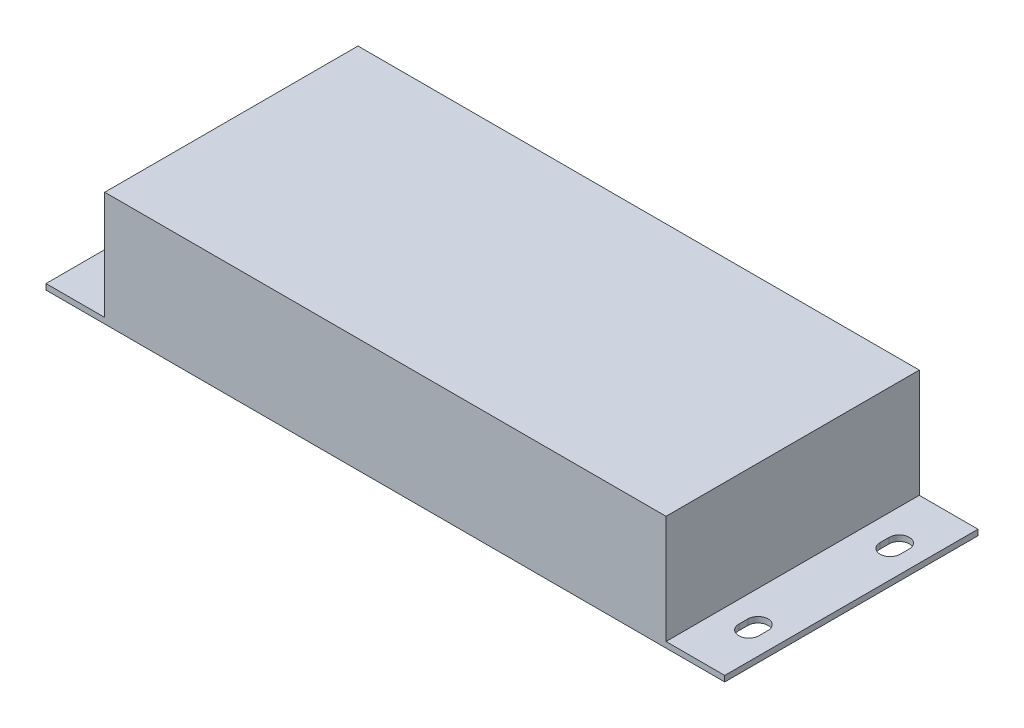
from build123d import *

# Parameters (mm, degrees)
SKETCH1_W           = 99.9236
SKETCH1_H           = 45.085
BOSS_EXTRUDE1_DEPTH = 19.304
SKETCH2_W           = 120.8278
SKETCH2_H           = 45.085
BOSS_EXTRUDE2_DEPTH = 1.016
SKETCH3_W           = 86.580193544
SKETCH3_H           = 5.780372674
CUT_EXTRUDE1_DEPTH  = 5


with BuildPart() as part:
    # Sketch1 → Boss-Extrude1 (new body)
    with BuildSketch(Plane(origin=(0, 0, 0), x_dir=(1, 0, 0), z_dir=(0, 1, 0))):
        with Locations((49.9618, 22.5425)):
            Rectangle(SKETCH1_W, SKETCH1_H)
    extrude(amount=BOSS_EXTRUDE1_DEPTH)

    # Sketch2 → Boss-Extrude2 (add)
    with BuildSketch(Plane.XZ):
        with Locations((49.9618, -22.5425)):
            Rectangle(SKETCH2_W, SKETCH2_H)
        with BuildLine():
            Line((-3.7973, -9.1567), (-3.7973, -10.7823))
            ThreePointArc((-3.7973, -10.7823), (-5.588, -12.573), (-7.3787, -10.7823))
            Line((-7.3787, -10.7823), (-7.3787, -9.1567))
            ThreePointArc((-7.3787, -9.1567), (-5.588, -7.366), (-3.7973, -9.1567))
        make_face(mode=Mode.SUBTRACT)
        with BuildLine():
            Line((-3.7973, -35.9283), (-3.7973, -34.3027))
            ThreePointArc((-3.7973, -34.3027), (-5.588, -32.512), (-7.3787, -34.3027))
            Line((-7.3787, -34.3027), (-7.3787, -35.9283))
            ThreePointArc((-7.3787, -35.9283), (-5.588, -37.719), (-3.7973, -35.9283))
        make_face(mode=Mode.SUBTRACT)
        with BuildLine():
            Line((103.7209, -9.1567), (103.7209, -10.7823))
            ThreePointArc((103.7209, -10.7823), (105.5116, -12.573), (107.3023, -10.7823))
            Line((107.3023, -10.7823), (107.3023, -9.1567))
            ThreePointArc((107.3023, -9.1567), (105.5116, -7.366), (103.7209, -9.1567))
        make_face(mode=Mode.SUBTRACT)
        with BuildLine():
            Line((103.7209, -35.9283), (103.7209, -34.3027))
            ThreePointArc((103.7209, -34.3027), (105.5116, -32.512), (107.3023, -34.3027))
            Line((107.3023, -34.3027), (107.3023, -35.9283))
            ThreePointArc((107.3023, -35.9283), (105.5116, -37.719), (103.7209, -35.9283))
        make_face(mode=Mode.SUBTRACT)
    extrude(amount=BOSS_EXTRUDE2_DEPTH)

    # Sketch3 → Cut-Extrude1 (cut)
    with BuildSketch(Plane(origin=(0, 0, -45.085), x_dir=(-1, 0, 0), z_dir=(0, 0, -1))):
        with Locations((-49.9618, 9.652)):
            Rectangle(SKETCH3_W, SKETCH3_H)
    extrude(amount=-CUT_EXTRUDE1_DEPTH, mode=Mode.SUBTRACT)


solid = part.part
